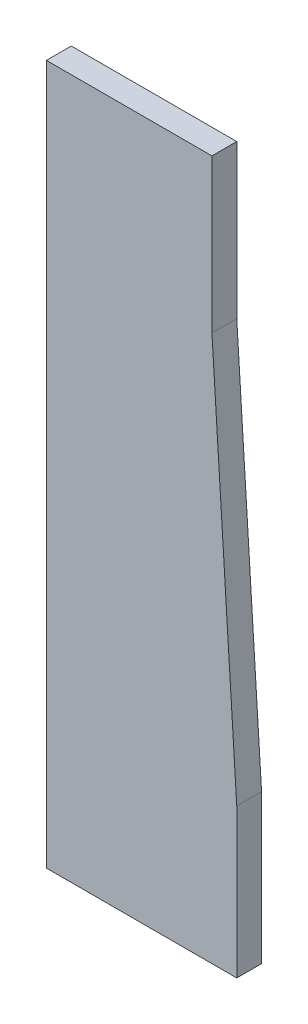
from build123d import *

# Parameters (mm, degrees)
BOSS_EXTRUDE1_DEPTH = 19.05


with BuildPart() as part:
    # Sketch1 → Boss-Extrude1 (new body)
    with BuildSketch(Plane.XY):
        Polygon((82.03946, -5040.331407449), (82.03946, -5577.129530575), (228.088766336, -5577.129530575), (228.088766336, -5462.794671748), (209.03946, -5158.005770365), (209.03946, -5040.331407449), align=None)
    extrude(amount=BOSS_EXTRUDE1_DEPTH)


solid = part.part
